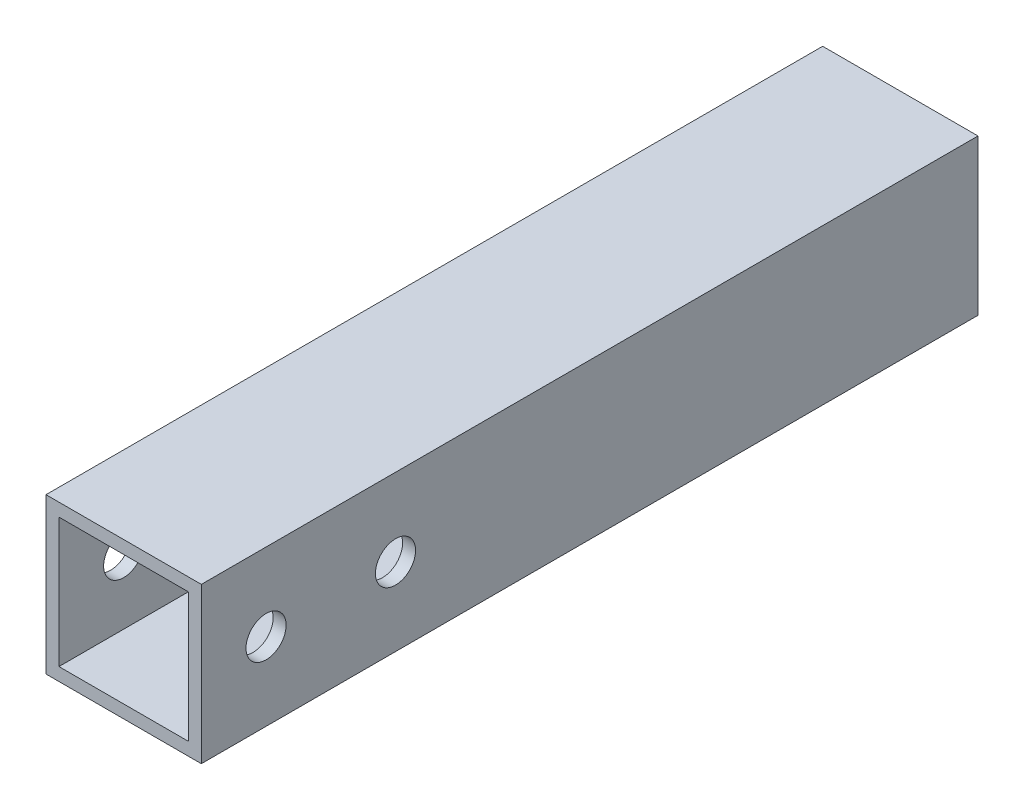
from build123d import *

# Parameters (mm, degrees)
SKETCH_1_W          = 12
SKETCH_1_H          = 12
SKETCH_1_W_2        = 10
SKETCH_1_H_2        = 10
EXTRUDE_1_DEPTH     = 60
SKETCH_2_R          = 1.55
CUT_EXTRUDE_2_DEPTH = 63.353829072


with BuildPart() as part:
    # 草图1 → 凸台-拉伸1 (new body)
    with BuildSketch(Plane.XY):
        with Locations((6, 6)):
            Rectangle(SKETCH_1_W, SKETCH_1_H)
        with Locations((6, 6)):
            Rectangle(SKETCH_1_W_2, SKETCH_1_H_2, mode=Mode.SUBTRACT)
    extrude(amount=EXTRUDE_1_DEPTH)

    # 草图2 → 切除-拉伸2 (cut, through all)
    with BuildSketch(Plane.YZ.offset(12)):
        with Locations(Location((6, 45, 0), (0, 0, 270))):
            Circle(SKETCH_2_R)
        with Locations(Location((6, 55, 0), (0, 0, 270))):
            Circle(SKETCH_2_R)
    extrude(amount=-CUT_EXTRUDE_2_DEPTH, mode=Mode.SUBTRACT)


solid = part.part
